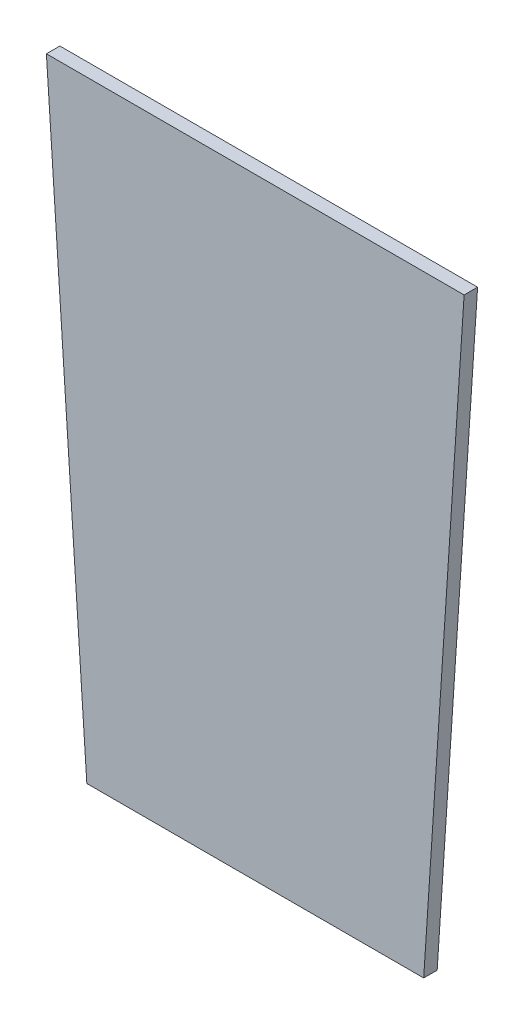
from build123d import *

# Parameters (mm, degrees)
DODANIE_WYCI_GNI_CIE1_DEPTH = 10


with BuildPart() as part:
    # Szkic1 → Dodanie-wyciągnięcie1 (new body)
    with BuildSketch(Plane.XY):
        Polygon((-155, 227.004955893), (155, 227.004955893), (125, -227.004955893), (-125, -227.004955893), align=None)
    extrude(amount=DODANIE_WYCI_GNI_CIE1_DEPTH)


solid = part.part
